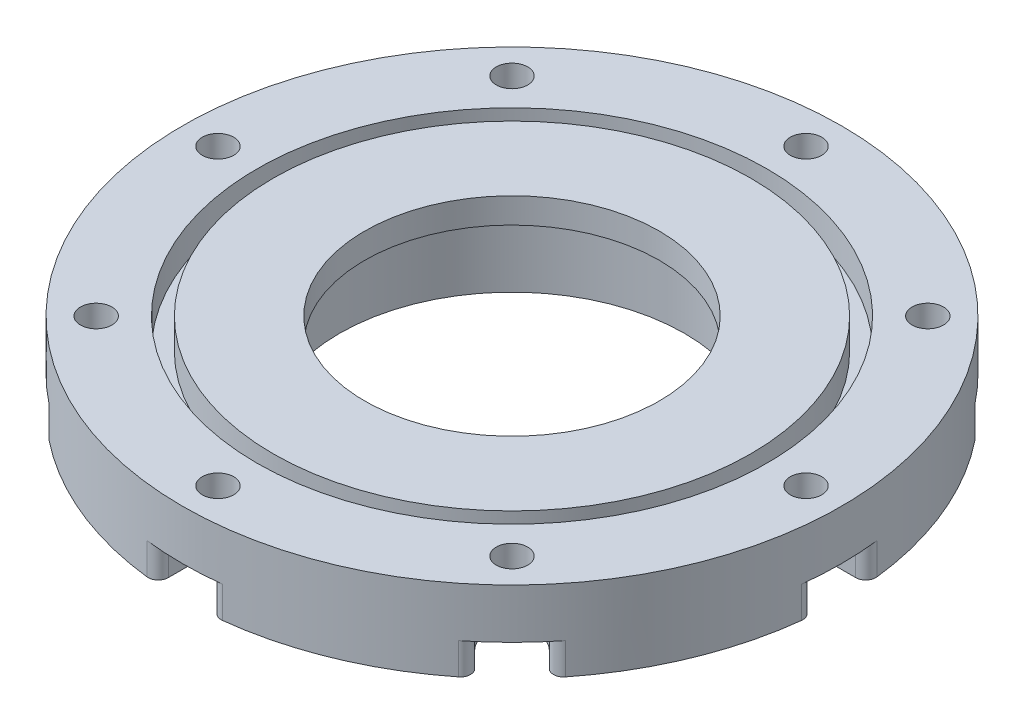
from build123d import *

# Parameters (mm, degrees)
ESQUISSE2_R             = 3.1
ENL_V_MAT_EXTRU_1_DEPTH = 95.074438611
ESQUISSE4_OUTSIDE_W     = 168.986
ESQUISSE4_OUTSIDE_H     = 168.986
ESQUISSE4_OUTSIDE_R     = 42.05
ENL_V_MAT_EXTRU_3_DEPTH = 4
ESQUISSE3_R             = 5.1
ENL_V_MAT_EXTRU_2_DEPTH = 6.2
ENL_V_MAT_EXTRU_4_DEPTH = 6.2
CONG_2_R                = 2


with BuildPart() as part:
    # Esquisse1 → Révolution1 (revolve)
    with BuildSketch(Plane.XY, mode=Mode.PRIVATE) as r_volution1_sk:
        Polygon((-34.05, 0), (-34.05, 15), (-29.05, 15), (-29.05, 20), (-47.1, 20), (-47.1, 14), (-50.3, 14), (-50.3, 20), (-65, 20), (-65, 0), align=None)
    revolve(r_volution1_sk.sketch.rotate(Axis((0, 0, 0), (0, 1, 0)), 270), axis=Axis((0, 0, 0), (0, 1, 0)))

    # Esquisse2 → Enlèv. mat.-Extru.1 (cut, through all)
    with BuildSketch(Plane.XZ):
        with Locations(Location((0, 58, 0), (0, 0, 270))):
            Circle(ESQUISSE2_R)
        with Locations(Location((41.012193309, 41.012193309, 0), (0, 0, 270))):
            Circle(ESQUISSE2_R)
        with Locations(Location((58, 0, 0), (0, 0, 270))):
            Circle(ESQUISSE2_R)
        with Locations(Location((41.012193309, -41.012193309, 0), (0, 0, 270))):
            Circle(ESQUISSE2_R)
        with Locations(Location((0, -58, 0), (0, 0, 270))):
            Circle(ESQUISSE2_R)
        with Locations(Location((-41.012193309, -41.012193309, 0), (0, 0, 270))):
            Circle(ESQUISSE2_R)
        with Locations(Location((-58, 0, 0), (0, 0, 270))):
            Circle(ESQUISSE2_R)
        with Locations(Location((-41.012193309, 41.012193309, 0), (0, 0, 270))):
            Circle(ESQUISSE2_R)
    extrude(amount=-ENL_V_MAT_EXTRU_1_DEPTH, mode=Mode.SUBTRACT)

    # Esquisse4 outside → Enlèv. mat.-Extru.3 (cut)
    with BuildSketch(Plane.XZ):
        Rectangle(ESQUISSE4_OUTSIDE_W, ESQUISSE4_OUTSIDE_H)
        with Locations(Location((0, 0, 0), (0, 0, 270))):
            Circle(ESQUISSE4_OUTSIDE_R, mode=Mode.SUBTRACT)
    extrude(amount=-ENL_V_MAT_EXTRU_3_DEPTH, mode=Mode.SUBTRACT)

    # Esquisse3 → Enlèv. mat.-Extru.2 (cut)
    with BuildSketch(Plane.XZ.offset(-4)):
        with Locations(Location((0, 58, 0), (0, 0, 270))):
            Circle(ESQUISSE3_R)
        with Locations(Location((41.012193309, 41.012193309, 0), (0, 0, 270))):
            Circle(ESQUISSE3_R)
        with Locations(Location((58, 0, 0), (0, 0, 270))):
            Circle(ESQUISSE3_R)
        with Locations(Location((41.012193309, -41.012193309, 0), (0, 0, 270))):
            Circle(ESQUISSE3_R)
        with Locations(Location((0, -58, 0), (0, 0, 270))):
            Circle(ESQUISSE3_R)
        with Locations(Location((-41.012193309, -41.012193309, 0), (0, 0, 270))):
            Circle(ESQUISSE3_R)
        with Locations(Location((-58, 0, 0), (0, 0, 270))):
            Circle(ESQUISSE3_R)
        with Locations(Location((-41.012193309, 41.012193309, 0), (0, 0, 270))):
            Circle(ESQUISSE3_R)
    extrude(amount=-ENL_V_MAT_EXTRU_2_DEPTH, mode=Mode.SUBTRACT)

    # Esquisse5 → Enlèv. mat.-Extru.4 (cut)
    with BuildSketch(Plane.XZ.offset(-4)):
        with BuildLine():
            Line((5.2, -58), (5.2, -69.173010208))
            ThreePointArc((5.2, -69.173010208), (0, -74.373010208), (-5.2, -69.173010208))
            Line((-5.2, -69.173010208), (-5.2, -58))
            ThreePointArc((-5.2, -58), (0, -52.8), (5.2, -58))
        make_face()
        with BuildLine():
            Line((-37.335238047, -44.689148571), (-45.235749331, -52.589659855))
            ThreePointArc((-45.235749331, -52.589659855), (-52.589659855, -52.589659855), (-52.589659855, -45.235749331))
            Line((-52.589659855, -45.235749331), (-44.689148571, -37.335238047))
            ThreePointArc((-44.689148571, -37.335238047), (-37.335238047, -37.335238047), (-37.335238047, -44.689148571))
        make_face()
        with BuildLine():
            Line((-58, -5.2), (-69.173010208, -5.2))
            ThreePointArc((-69.173010208, -5.2), (-74.373010208, 0), (-69.173010208, 5.2))
            Line((-69.173010208, 5.2), (-58, 5.2))
            ThreePointArc((-58, 5.2), (-52.8, 0), (-58, -5.2))
        make_face()
        with BuildLine():
            Line((-44.689148571, 37.335238047), (-52.589659855, 45.235749331))
            ThreePointArc((-52.589659855, 45.235749331), (-52.589659855, 52.589659855), (-45.235749331, 52.589659855))
            Line((-45.235749331, 52.589659855), (-37.335238047, 44.689148571))
            ThreePointArc((-37.335238047, 44.689148571), (-37.335238047, 37.335238047), (-44.689148571, 37.335238047))
        make_face()
        with BuildLine():
            Line((-5.2, 58), (-5.2, 69.173010208))
            ThreePointArc((-5.2, 69.173010208), (0, 74.373010208), (5.2, 69.173010208))
            Line((5.2, 69.173010208), (5.2, 58))
            ThreePointArc((5.2, 58), (0, 52.8), (-5.2, 58))
        make_face()
        with BuildLine():
            Line((37.335238047, 44.689148571), (45.235749331, 52.589659855))
            ThreePointArc((45.235749331, 52.589659855), (52.589659855, 52.589659855), (52.589659855, 45.235749331))
            Line((52.589659855, 45.235749331), (44.689148571, 37.335238047))
            ThreePointArc((44.689148571, 37.335238047), (37.335238047, 37.335238047), (37.335238047, 44.689148571))
        make_face()
        with BuildLine():
            Line((58, 5.2), (69.173010208, 5.2))
            ThreePointArc((69.173010208, 5.2), (74.373010208, 0), (69.173010208, -5.2))
            Line((69.173010208, -5.2), (58, -5.2))
            ThreePointArc((58, -5.2), (52.8, 0), (58, 5.2))
        make_face()
        with BuildLine():
            Line((44.689148571, -37.335238047), (52.589659855, -45.235749331))
            ThreePointArc((52.589659855, -45.235749331), (52.589659855, -52.589659855), (45.235749331, -52.589659855))
            Line((45.235749331, -52.589659855), (37.335238047, -44.689148571))
            ThreePointArc((37.335238047, -44.689148571), (37.335238047, -37.335238047), (44.689148571, -37.335238047))
        make_face()
    extrude(amount=-ENL_V_MAT_EXTRU_4_DEPTH, mode=Mode.SUBTRACT)

    # Congé2
    cong_2_edges = [part.edges().sort_by_distance(p)[0] for p in [
        (49.491581748, 7.1, -42.137671223),
        (42.137671223, 7.1, -49.491581748),
        (64.791666131, 7.1, 5.2),
        (64.791666131, 7.1, -5.2),
        (42.137671223, 7.1, 49.491581748),
        (49.491581748, 7.1, 42.137671223),
        (-5.2, 7.1, 64.791666131),
        (5.2, 7.1, 64.791666131),
        (-49.491581748, 7.1, 42.137671223),
        (-42.137671223, 7.1, 49.491581748),
        (-64.791666131, 7.1, -5.2),
        (-64.791666131, 7.1, 5.2),
        (-42.137671223, 7.1, -49.491581748),
        (-49.491581748, 7.1, -42.137671223),
        (5.2, 7.1, -64.791666131),
        (-5.2, 7.1, -64.791666131),
    ]]
    fillet(cong_2_edges, radius=CONG_2_R)


solid = part.part
